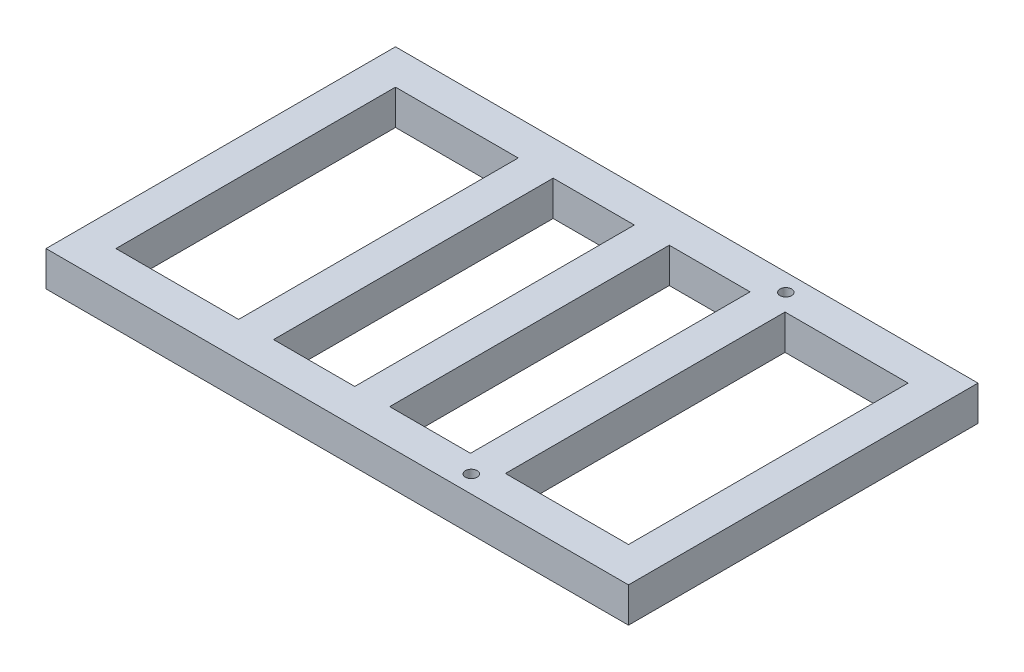
from build123d import *

# Parameters (mm, degrees)
SKETCH2_W           = 500
SKETCH2_H           = 300
SKETCH2_W_2         = 440
SKETCH2_H_2         = 240
BOSS_EXTRUDE1_DEPTH = 30
SKETCH3_W           = 30
SKETCH3_H           = 240
BOSS_EXTRUDE2_DEPTH = 30
SKETCH4_W           = 30
SKETCH4_H           = 240
BOSS_EXTRUDE3_DEPTH = 30
SKETCH8_R           = 5
CUT_EXTRUDE1_DEPTH  = 32
SKETCH9_R           = 5
CUT_EXTRUDE2_DEPTH  = 34


with BuildPart() as part:
    # Sketch2 → Boss-Extrude1 (new body)
    with BuildSketch(Plane(origin=(0, 0, 0), x_dir=(1, 0, 0), z_dir=(0, 1, 0))):
        Rectangle(SKETCH2_W, SKETCH2_H)
        Rectangle(SKETCH2_W_2, SKETCH2_H_2, mode=Mode.SUBTRACT)
    extrude(amount=BOSS_EXTRUDE1_DEPTH)

    # Sketch3 → Boss-Extrude2 (add)
    with BuildSketch(Plane(origin=(0, 30, 0), x_dir=(1, 0, 0), z_dir=(0, 1, 0))):
        Rectangle(SKETCH3_W, SKETCH3_H)
    extrude(amount=-BOSS_EXTRUDE2_DEPTH)

    # Sketch4 → Boss-Extrude3 (add)
    with BuildSketch(Plane(origin=(0, 30, 0), x_dir=(1, 0, 0), z_dir=(0, 1, 0))):
        with Locations((-99.680978572, 0)):
            Rectangle(SKETCH4_W, SKETCH4_H)
        with Locations((99.36531106, 0)):
            Rectangle(SKETCH4_W, SKETCH4_H)
    extrude(amount=-BOSS_EXTRUDE3_DEPTH)

    # Sketch8 → Cut-Extrude1 (cut)
    with BuildSketch(Plane(origin=(0, 30, 0), x_dir=(1, 0, 0), z_dir=(0, 1, 0))):
        with Locations(Location((100.018449151, 135, 0), (0, 0, 270))):
            Circle(SKETCH8_R)
    extrude(amount=-CUT_EXTRUDE1_DEPTH, mode=Mode.SUBTRACT)

    # Sketch9 → Cut-Extrude2 (cut)
    with BuildSketch(Plane(origin=(0, 30, 0), x_dir=(1, 0, 0), z_dir=(0, 1, 0))):
        with Locations(Location((100.060395289, -135, 0), (0, 0, 270))):
            Circle(SKETCH9_R)
    extrude(amount=-CUT_EXTRUDE2_DEPTH, mode=Mode.SUBTRACT)


solid = part.part
